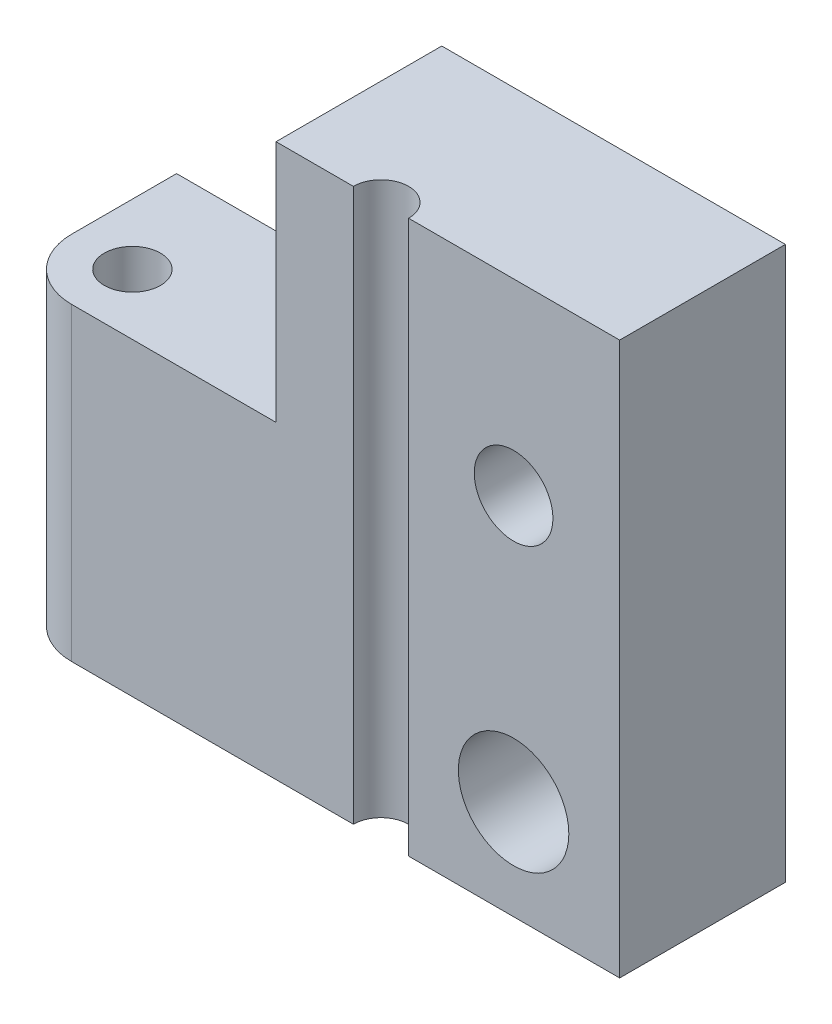
from build123d import *

# Parameters (mm, degrees)
BOSS_EXTRUDE1_DEPTH            = 15.875
F_52_0_0635_DIAMETER_HOLE1_D   = 1.6129
SKETCH3_W                      = 7.62
SKETCH3_H                      = 6.985
CUT_EXTRUDE1_DEPTH             = 24.835793107
SKETCH5_R                      = 1.5875
CUT_EXTRUDE2_DEPTH             = 3.302
BOSS_EXTRUDE2_DEPTH            = 1.5875
F_4_40_TAPPED_HOLE1_D          = 2.2606
F_1_16_0_0625_DIAMETER_HOLE1_D = 1.5875


with BuildPart() as part:
    # Sketch1 → Boss-Extrude1 (new body)
    with BuildSketch(Plane(origin=(0, 0, 0), x_dir=(1, 0, 0), z_dir=(0, 1, 0))):
        with BuildLine():
            Line((0, 1.74625), (0, 3.175))
            Line((0, 3.175), (17.49425, 3.175))
            Line((17.49425, 3.175), (17.49425, 0))
            Line((17.49425, 0), (11.43, 0))
            ThreePointArc((11.43, 0), (10.63625, 0.79375), (9.8425, 0))
            Line((9.8425, 0), (1.74625, 0))
            ThreePointArc((1.74625, 0), (0.511464783, 0.511464783), (0, 1.74625))
        make_face()
    extrude(amount=BOSS_EXTRUDE1_DEPTH)

    # #52 (0.0635) Diameter Hole1 (through all)
    with Locations(Plane(origin=(1.74625, 15.875, -1.74625), x_dir=(0, 0, 1), z_dir=(0, 1, 0))):
        with Locations((0, 0)):
            Hole(F_52_0_0635_DIAMETER_HOLE1_D / 2)

    # Sketch3 → Cut-Extrude1 (cut, through all)
    with BuildSketch(Plane(origin=(0, 0, -3.175), x_dir=(-1, 0, 0), z_dir=(0, 0, -1))):
        with Locations((-3.81, 12.3825)):
            Rectangle(SKETCH3_W, SKETCH3_H)
    extrude(amount=-CUT_EXTRUDE1_DEPTH, mode=Mode.SUBTRACT)

    # Sketch5 → Cut-Extrude2 (cut)
    with BuildSketch(Plane.XY):
        with Locations((14.44625, 2.8575)):
            Circle(SKETCH5_R)
    extrude(amount=-CUT_EXTRUDE2_DEPTH, mode=Mode.SUBTRACT)

    # Sketch7 → Boss-Extrude2 (add)
    with BuildSketch(Plane(origin=(0, 0, -3.175), x_dir=(-1, 0, 0), z_dir=(0, 0, -1))):
        Polygon((-17.49425, 0), (0, 0), (0, 8.89), (-7.62, 8.89), (-7.62, 15.875), (-17.49425, 15.875), align=None)
    extrude(amount=BOSS_EXTRUDE2_DEPTH)

    # #4-40 Tapped Hole1 (through all)
    with Locations(Plane(origin=(14.44625, 10.4775, 0), x_dir=(1, 0, 0), z_dir=(0, 0, 1))):
        with Locations((0, 0)):
            Hole(F_4_40_TAPPED_HOLE1_D / 2)

    # 1/16 (0.0625) Diameter Hole1 (through all)
    with Locations(Plane(origin=(14.44625, 2.8575, -3.175), x_dir=(1, 0, 0), z_dir=(0, 0, 1))):
        with Locations((0, 0)):
            Hole(F_1_16_0_0625_DIAMETER_HOLE1_D / 2)


solid = part.part
